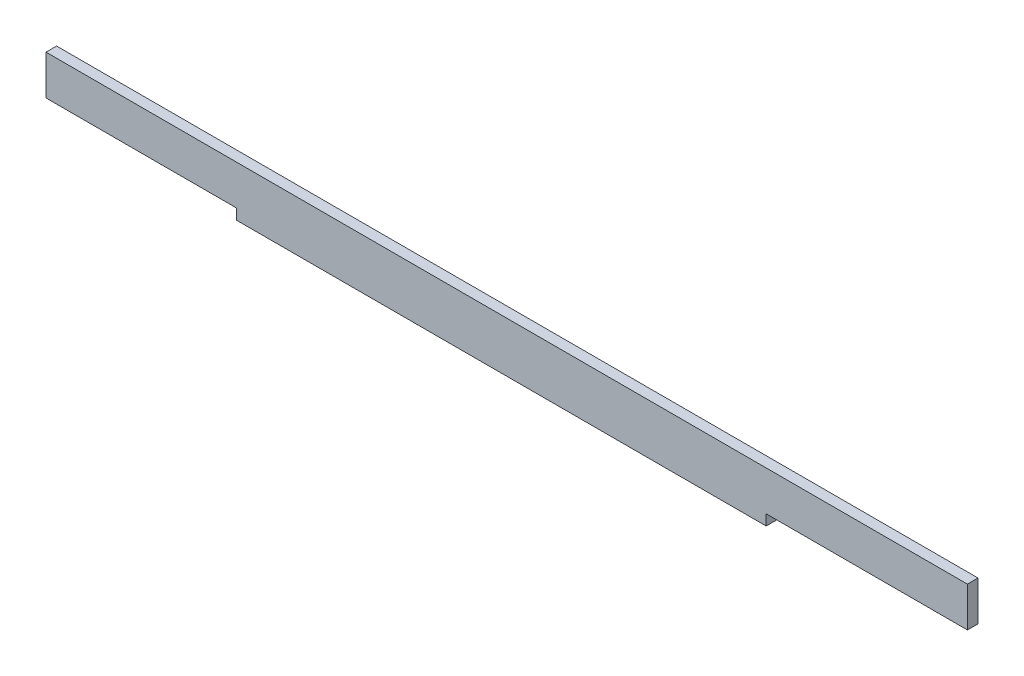
from build123d import *

# Parameters (mm, degrees)
BOSS_EXTRUDE1_DEPTH = 4


with BuildPart() as part:
    # Sketch2 → Boss-Extrude1 (new body)
    with BuildSketch(Plane.XY):
        Polygon((-171.636958624, 1.54619828), (-99.636958624, 1.54619828), (-99.636958624, -2.45380172), (100.363041376, -2.45380172), (100.363041376, 1.54619828), (176.363041376, 1.54619828), (176.363041376, 16.54619828), (-171.636958624, 16.54619828), align=None)
    extrude(amount=BOSS_EXTRUDE1_DEPTH)


solid = part.part
